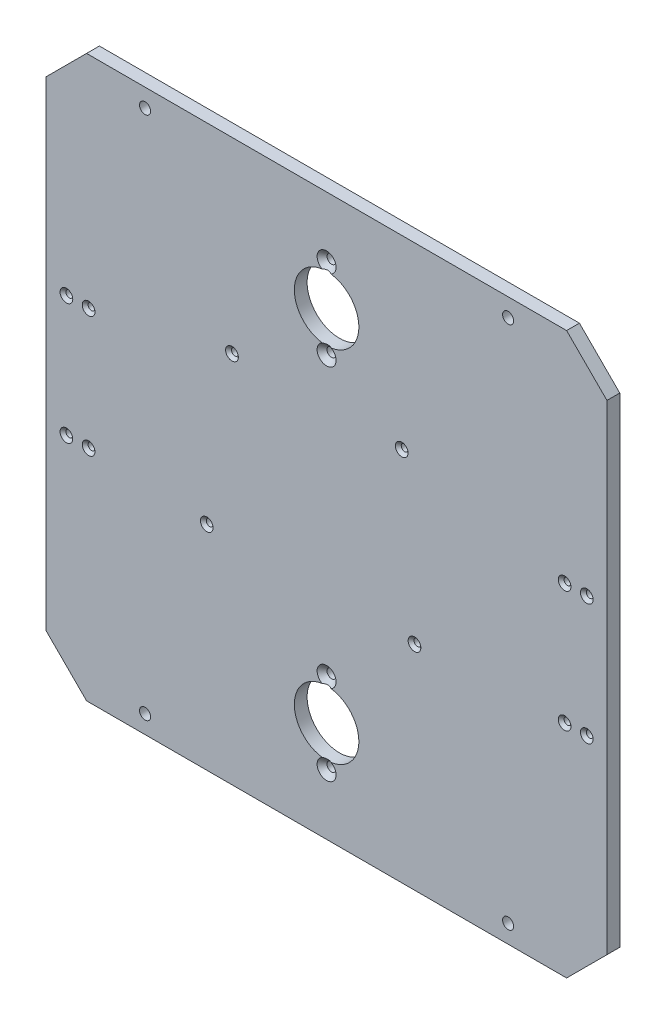
from build123d import *

# Parameters (mm, degrees)
SKETCH1_W                                       = 278
SKETCH1_H                                       = 278
BOSS_EXTRUDE1_DEPTH                             = 6.35
CHAMFER1_SIZE                                   = 20
SKETCH4_R                                       = 2.75
CUT_EXTRUDE2_DEPTH                              = 76.2
SKETCH8_R                                       = 16
CUT_EXTRUDE4_DEPTH                              = 105
CSK_FOR_M4_FLAT_HEAD_MACHINE_SCREW2_D           = 4.5
CSK_FOR_M4_FLAT_HEAD_MACHINE_SCREW2_CSINK_D     = 9.4
CSK_FOR_M4_FLAT_HEAD_MACHINE_SCREW2_CSINK_ANGLE = 90
CSK_FOR_M3_FLAT_HEAD_MACHINE_SCREW1_D           = 3.4
CSK_FOR_M3_FLAT_HEAD_MACHINE_SCREW1_CSINK_D     = 6.3
CSK_FOR_M3_FLAT_HEAD_MACHINE_SCREW1_CSINK_ANGLE = 90
CSK_FOR_M3_FLAT_HEAD_MACHINE_SCREW2_D           = 3.4
CSK_FOR_M3_FLAT_HEAD_MACHINE_SCREW2_CSINK_D     = 6.3
CSK_FOR_M3_FLAT_HEAD_MACHINE_SCREW2_CSINK_ANGLE = 90


with BuildPart() as part:
    # Sketch1 → Boss-Extrude1 (new body)
    with BuildSketch(Plane.XY):
        Rectangle(SKETCH1_W, SKETCH1_H)
    extrude(amount=BOSS_EXTRUDE1_DEPTH)

    # Chamfer1
    chamfer1_edges = [part.edges().sort_by_distance(p)[0] for p in [
        (-139, 139, 3.175),
        (139, 139, 3.175),
        (139, -139, 3.175),
        (-139, -139, 3.175),
    ]]
    chamfer(chamfer1_edges, length=CHAMFER1_SIZE)

    # Sketch4 → Cut-Extrude2 (cut)
    with BuildSketch(Plane.XY.offset(6.35)):
        with Locations((-90, 130)):
            Circle(SKETCH4_R)
        with Locations((0, 151)):
            Circle(SKETCH4_R)
        with Locations((90, 130)):
            Circle(SKETCH4_R)
        with Locations((90, -130)):
            Circle(SKETCH4_R)
        with Locations((0, -151)):
            Circle(SKETCH4_R)
        with Locations((-90, -130)):
            Circle(SKETCH4_R)
    extrude(amount=-CUT_EXTRUDE2_DEPTH, mode=Mode.SUBTRACT)

    # Sketch8 → Cut-Extrude4 (cut)
    with BuildSketch(Plane.XY.offset(6.35)):
        with Locations((0, 89)):
            Circle(SKETCH8_R)
        with Locations((0, -89)):
            Circle(SKETCH8_R)
    extrude(amount=-CUT_EXTRUDE4_DEPTH, mode=Mode.SUBTRACT)

    # CSK for M4 Flat Head Machine Screw2 (through all)
    with Locations(Plane.XY.offset(6.35)):
        with Locations((0, 109), (0, 69), (0, -69), (0, -109)):
            CounterSinkHole(CSK_FOR_M4_FLAT_HEAD_MACHINE_SCREW2_D / 2, CSK_FOR_M4_FLAT_HEAD_MACHINE_SCREW2_CSINK_D / 2, counter_sink_angle=CSK_FOR_M4_FLAT_HEAD_MACHINE_SCREW2_CSINK_ANGLE)

    # CSK for M3 Flat Head Machine Screw1 (through all)
    with Locations(Plane.XY.offset(6.35)):
        with Locations((-129, 30), (-118, 30), (-118, -30), (-129, -30), (129, -30), (118, -30), (118, 30), (129, 30)):
            CounterSinkHole(CSK_FOR_M3_FLAT_HEAD_MACHINE_SCREW1_D / 2, CSK_FOR_M3_FLAT_HEAD_MACHINE_SCREW1_CSINK_D / 2, counter_sink_angle=CSK_FOR_M3_FLAT_HEAD_MACHINE_SCREW1_CSINK_ANGLE)

    # CSK for M3 Flat Head Machine Screw2 (through all)
    with Locations(Plane.XY.offset(6.35)):
        with Locations((-46.915752442, 46.109961681)):
            csk_for_m3_flat_head_machine_screw2 = CounterSinkHole(CSK_FOR_M3_FLAT_HEAD_MACHINE_SCREW2_D / 2, CSK_FOR_M3_FLAT_HEAD_MACHINE_SCREW2_CSINK_D / 2, counter_sink_angle=CSK_FOR_M3_FLAT_HEAD_MACHINE_SCREW2_CSINK_ANGLE)

    # Sketch-Pattern1: CSK for M3 Flat Head Machine Screw2 at 3 more places
    with Locations((84.166, 0.9568, 0), (90.5, -79.5, 0), (-12.5, -79.5, 0)):
        add(csk_for_m3_flat_head_machine_screw2, mode=Mode.SUBTRACT)


solid = part.part
